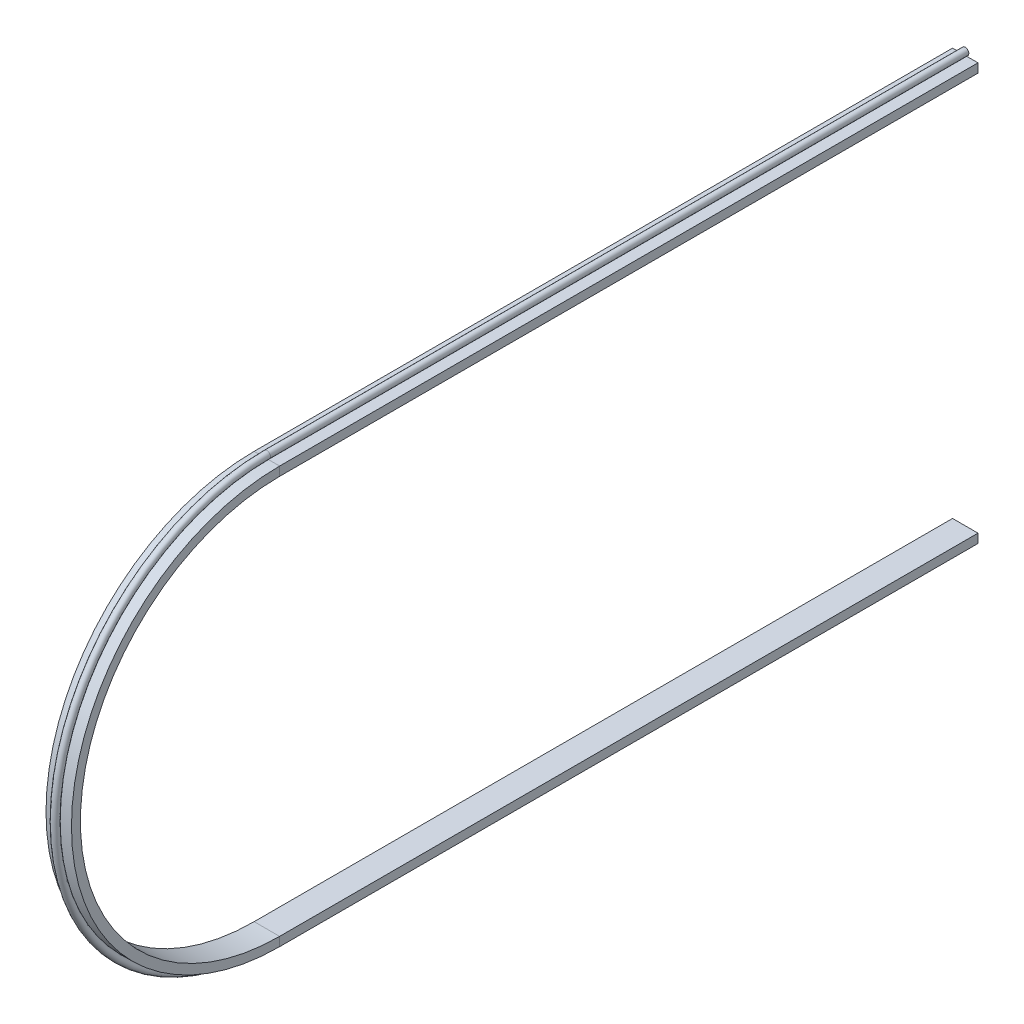
from build123d import *

# Parameters (mm, degrees)
SKETCH1_W = 12.5
SKETCH1_H = 4.4
SKETCH2_R = 1.75


with BuildPart() as part:
    # Sweep1: sweep along a path in Sketch3
    with BuildLine(Plane(origin=(0, 0, 0), x_dir=(0, 0, -1), z_dir=(1, 0, 0))) as sweep1_path:
        Line((0, 0), (-342.920367321, 0))
        ThreePointArc((-342.920367321, 0), (-442.920367321, 100), (-342.920367321, 200))
        Line((-342.920367321, 200), (0, 200))
    # Sketch1 → Sweep1 (sweep)
    with BuildSketch(Plane.XY):
        Rectangle(SKETCH1_W, SKETCH1_H)
    sweep(path=sweep1_path.line)


with BuildPart() as body_2:
    # Sweep2: sweep along a path in Sketch3<2>
    with BuildLine(Plane(origin=(0, 0, 0), x_dir=(0, 0, -1), z_dir=(1, 0, 0))) as sweep2_path:
        Line((0, 0), (-342.920367321, 0))
        ThreePointArc((-342.920367321, 0), (-442.920367321, 100), (-342.920367321, 200))
        Line((-342.920367321, 200), (0, 200))
    # Sketch2 → Sweep2 (sweep)
    with BuildSketch(Plane.XY):
        with Locations((0, -3.95)):
            Circle(SKETCH2_R)
    sweep(path=sweep2_path.line)


solid = Compound([part.part, body_2.part])
